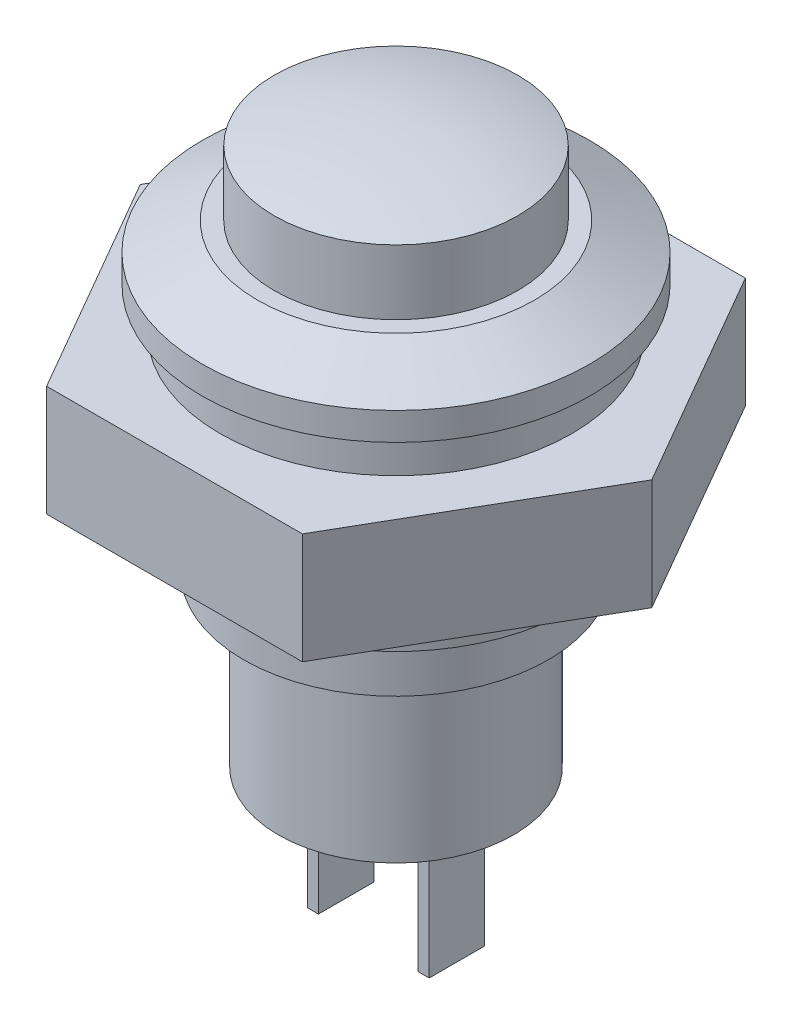
from build123d import *

# Parameters (mm, degrees)
BOSS_EXTRU_1_START = 1.5
BOSS_EXTRU_1_DEPTH = 4
CHANFREIN1_SIZE    = 1
CHANFREIN1_SIZE2   = 2
ESQUISSE3_W        = 0.4
ESQUISSE3_H        = 2
BOSS_EXTRU_2_DEPTH = 5


with BuildPart() as part:
    # Esquisse1 → Révolution1 (revolve)
    with BuildSketch(Plane.XY, mode=Mode.PRIVATE) as r_volution1_sk:
        with BuildLine():
            Line((4.4, 4.340153416), (4.4, 2))
            Line((4.4, 2), (7, 2))
            Line((7, 2), (7, 0))
            Line((7, 0), (6.35, 0))
            Line((6.35, 0), (6.35, -7))
            Line((6.35, -7), (5.5, -7))
            Line((5.5, -7), (5.5, -9))
            Line((5.5, -9), (4.25, -9))
            Line((4.25, -9), (4.25, -15.1))
            Line((4.25, -15.1), (0, -15.1))
            Line((0, -15.1), (0, 5))
            ThreePointArc((0, 5), (2.224600948, 4.834121161), (4.4, 4.340153416))
        make_face()
    revolve(r_volution1_sk.sketch.rotate(Axis((0, 15.574511932, 0), (0, -1, 0)), 90), axis=Axis((0, 15.574511932, 0), (0, -1, 0)))

    # Esquisse2 → Boss.-Extru.1 (add)
    with BuildSketch(Plane.XZ.offset(BOSS_EXTRU_1_START)):
        Polygon((4.618802154, -8), (9.237604307, 0), (4.618802154, 8), (-4.618802154, 8), (-9.237604307, 0), (-4.618802154, -8), align=None)
    extrude(amount=BOSS_EXTRU_1_DEPTH)

    # Chanfrein1
    chanfrein1_edges = [part.edges().sort_by_distance(p)[0] for p in [
        (0, 2, -7),
    ]]
    chanfrein1_side = [part.faces().sort_by_distance(p)[0] for p in [
        (0, 1, -7),
    ]]
    chamfer(chanfrein1_edges, length=CHANFREIN1_SIZE, length2=CHANFREIN1_SIZE2, reference=chanfrein1_side[0])

    # Esquisse3 → Boss.-Extru.2 (add)
    with BuildSketch(Plane.XZ.offset(15.1)):
        with Locations((-2, 0)):
            Rectangle(ESQUISSE3_W, ESQUISSE3_H)
    boss_extru_2 = extrude(amount=BOSS_EXTRU_2_DEPTH)

    # Symétrie1: Boss.-Extru.2 across plane
    add(boss_extru_2.mirror(Plane(origin=(0, 0, 0), x_dir=(0, 0, 1), z_dir=(1, 0, 0))))


solid = part.part
